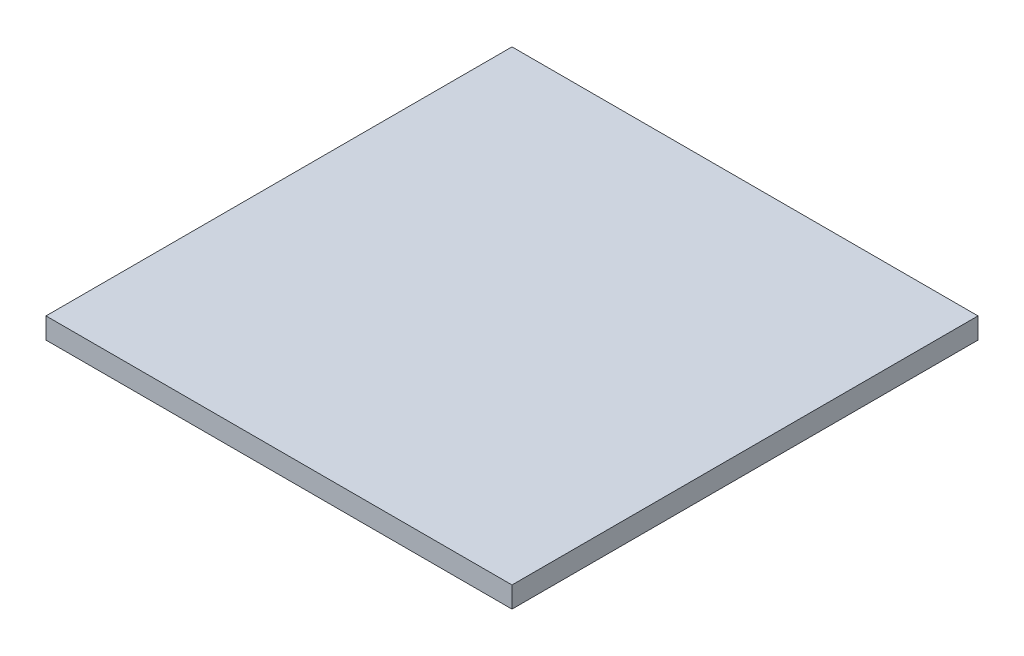
from build123d import *

# Parameters (mm, degrees)
ESQUISSE1_W        = 400
ESQUISSE1_H        = 400
BOSS_EXTRU_1_DEPTH = 18


with BuildPart() as part:
    # Esquisse1 → Boss.-Extru.1 (new body)
    with BuildSketch(Plane(origin=(0, 0, 0), x_dir=(1, 0, 0), z_dir=(0, 1, 0))):
        Rectangle(ESQUISSE1_W, ESQUISSE1_H)
    extrude(amount=BOSS_EXTRU_1_DEPTH)


solid = part.part
